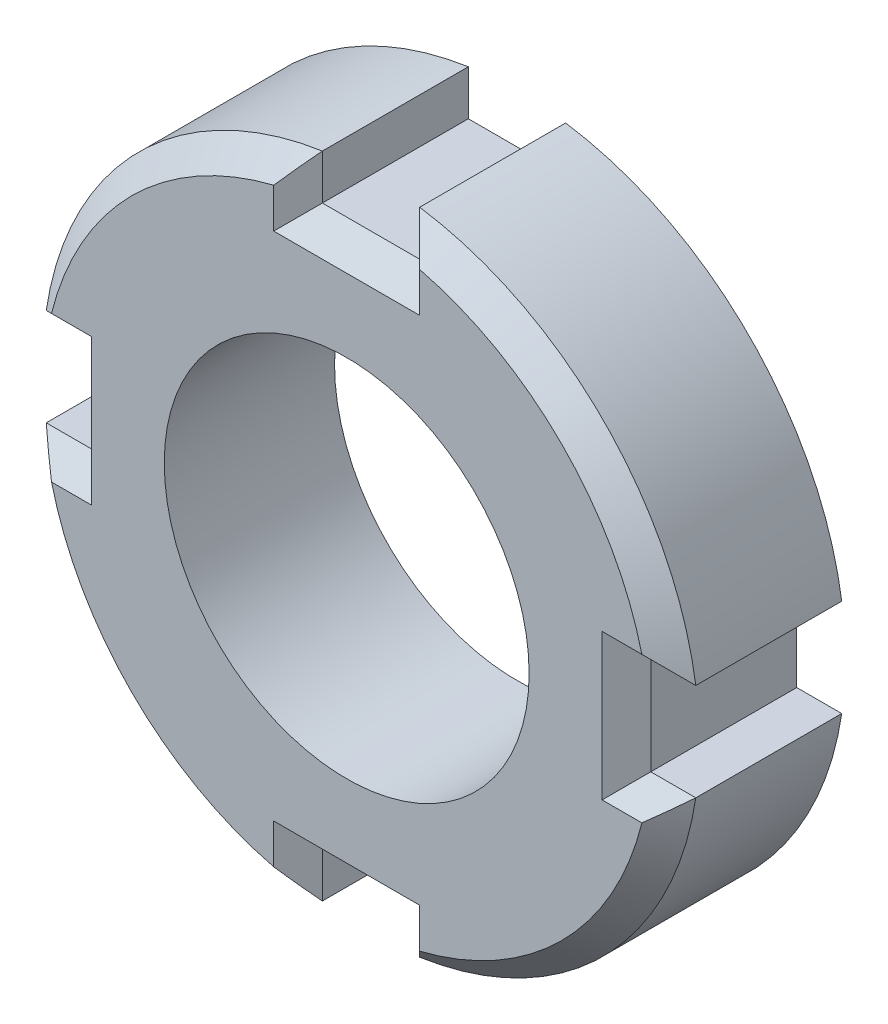
from build123d import *

# Parameters (mm, degrees)
SKETCH1_R           = 7.5
BOSS_EXTRUDE1_DEPTH = 7
CHAMFER1_SIZE       = 1


with BuildPart() as part:
    # Sketch1 → Boss-Extrude1 (new body)
    with BuildSketch(Plane.XY):
        with BuildLine():
            Line((11.5, -2), (11.5, 2))
            Line((11.5, 2), (13.351029923, 2))
            ThreePointArc((13.351029923, 2), (9.545941546, 9.545941546), (2, 13.351029923))
            Line((2, 13.351029923), (2, 11.5))
            Line((2, 11.5), (-2, 11.5))
            Line((-2, 11.5), (-2, 13.351029923))
            ThreePointArc((-2, 13.351029923), (-9.545941546, 9.545941546), (-13.351029923, 2))
            Line((-13.351029923, 2), (-11.5, 2))
            Line((-11.5, 2), (-11.5, -2))
            Line((-11.5, -2), (-13.351029923, -2))
            ThreePointArc((-13.351029923, -2), (-9.545941546, -9.545941546), (-2, -13.351029923))
            Line((-2, -13.351029923), (-2, -11.5))
            Line((-2, -11.5), (2, -11.5))
            Line((2, -11.5), (2, -13.351029923))
            ThreePointArc((2, -13.351029923), (9.545941546, -9.545941546), (13.351029923, -2))
            Line((13.351029923, -2), (11.5, -2))
        make_face()
        Circle(SKETCH1_R, mode=Mode.SUBTRACT)
    extrude(amount=BOSS_EXTRUDE1_DEPTH)

    # Chamfer1
    chamfer1_edges = [part.edges().sort_by_distance(p)[0] for p in [
        (12.425514961, 2, 7),
        (9.545941546, 9.545941546, 7),
        (2, 12.425514961, 7),
        (0, 11.5, 7),
        (-2, 12.425514961, 7),
        (-9.545941546, 9.545941546, 7),
        (-12.425514961, 2, 7),
        (-11.5, 0, 7),
        (-12.425514961, -2, 7),
        (-9.545941546, -9.545941546, 7),
        (-2, -12.425514961, 7),
        (0, -11.5, 7),
        (2, -12.425514961, 7),
        (9.545941546, -9.545941546, 7),
        (12.425514961, -2, 7),
        (11.5, 0, 7),
    ]]
    chamfer(chamfer1_edges, length=CHAMFER1_SIZE)


solid = part.part
